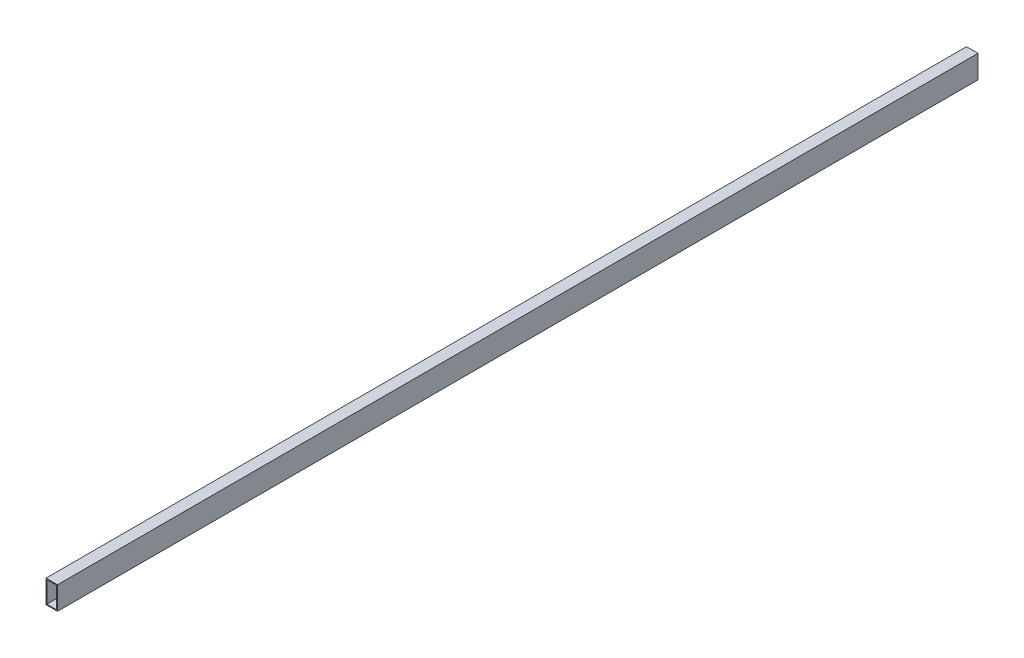
from build123d import *

# Parameters (mm, degrees)
CROQUIS1_W              = 50
CROQUIS1_H              = 100
CROQUIS1_W_2            = 42
CROQUIS1_H_2            = 92
SALIENTE_EXTRUIR1_DEPTH = 4000


with BuildPart() as part:
    # Croquis1 → Saliente-Extruir1 (new body)
    with BuildSketch(Plane.XY):
        Rectangle(CROQUIS1_W, CROQUIS1_H)
        Rectangle(CROQUIS1_W_2, CROQUIS1_H_2, mode=Mode.SUBTRACT)
    extrude(amount=SALIENTE_EXTRUIR1_DEPTH)


solid = part.part
